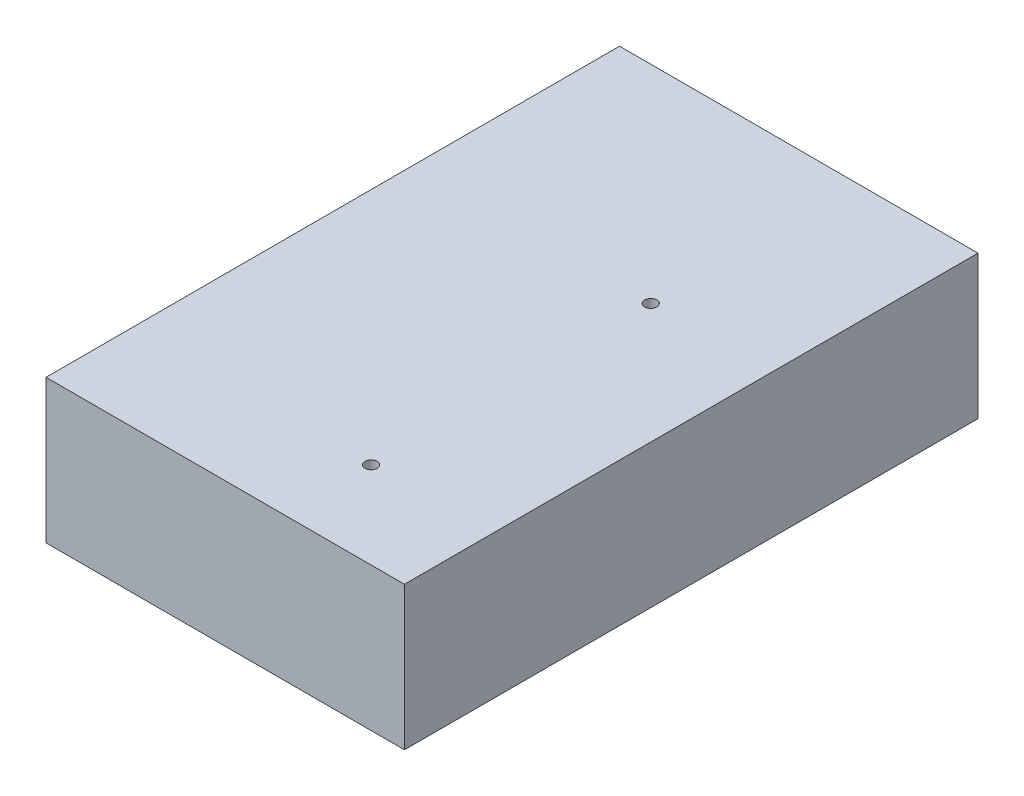
from build123d import *

# Parameters (mm, degrees)
SKETCH_1_W          = 100
SKETCH_1_H          = 160
EXTRUDE_1_DEPTH     = 40
SKETCH_2_R          = 1.7
CUT_EXTRUDE_1_DEPTH = 103.46950766


with BuildPart() as part:
    # 草图1 → 凸台-拉伸1 (new body)
    with BuildSketch(Plane(origin=(0, 0, 0), x_dir=(1, 0, 0), z_dir=(0, 1, 0))):
        Rectangle(SKETCH_1_W, SKETCH_1_H)
    extrude(amount=EXTRUDE_1_DEPTH)

    # 草图2 → 切除-拉伸1 (cut, through all)
    with BuildSketch(Plane.XZ):
        with Locations(Location((16.5, 55.8, 0), (0, 0, 270))):
            Circle(SKETCH_2_R)
        with Locations(Location((16.5, -22.2, 0), (0, 0, 270))):
            Circle(SKETCH_2_R)
    extrude(amount=-CUT_EXTRUDE_1_DEPTH, mode=Mode.SUBTRACT)


solid = part.part
